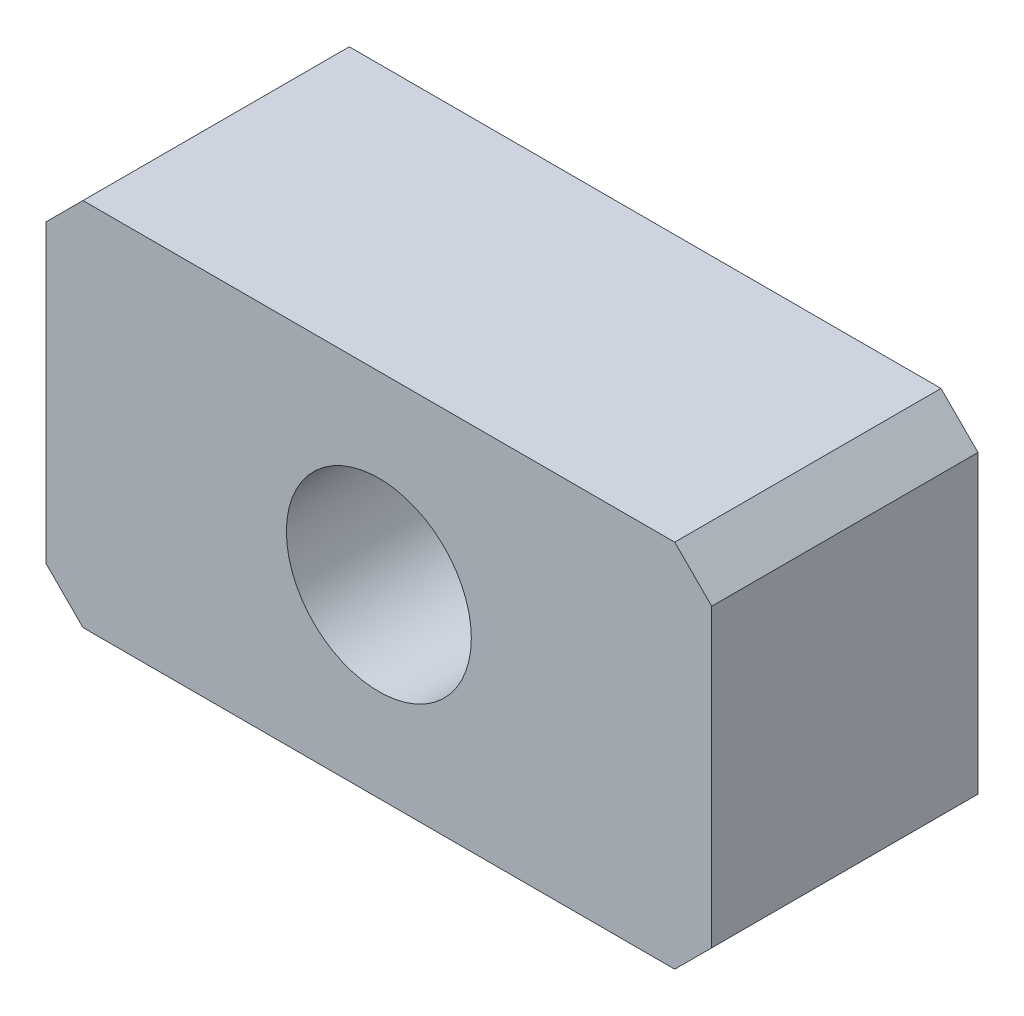
from build123d import *

# Parameters (mm, degrees)
SKETCH1_W           = 18
SKETCH1_H           = 10
SKETCH1_R           = 2.5
BOSS_EXTRUDE1_DEPTH = 7.2
CHAMFER1_SIZE       = 1


with BuildPart() as part:
    # Sketch1 → Boss-Extrude1 (new body)
    with BuildSketch(Plane.XY):
        Rectangle(SKETCH1_W, SKETCH1_H)
        Circle(SKETCH1_R, mode=Mode.SUBTRACT)
    extrude(amount=BOSS_EXTRUDE1_DEPTH)

    # Chamfer1
    chamfer1_edges = [part.edges().sort_by_distance(p)[0] for p in [
        (-9, 5, 3.6),
        (9, 5, 3.6),
        (9, -5, 3.6),
        (-9, -5, 3.6),
    ]]
    chamfer(chamfer1_edges, length=CHAMFER1_SIZE)


solid = part.part
